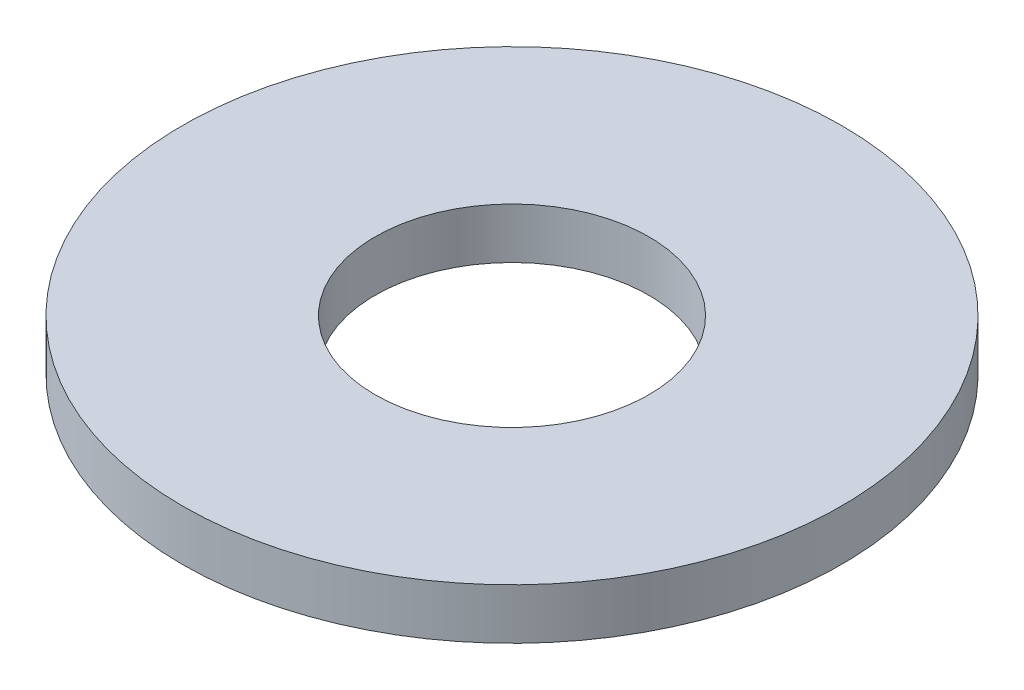
from build123d import *

# Parameters (mm, degrees)
ESQUISSE1_R        = 3.25
ESQUISSE1_R_2      = 1.35
BOSS_EXTRU_1_DEPTH = 0.25


with BuildPart() as part:
    # Esquisse1 → Boss.-Extru.1 (new, symmetric)
    with BuildSketch(Plane(origin=(0, 0, 0), x_dir=(1, 0, 0), z_dir=(0, 1, 0))):
        with Locations(Location((0, 0, 0), (0, 0, 270))):
            Circle(ESQUISSE1_R)
        with Locations(Location((0, 0, 0), (0, 0, 270))):
            Circle(ESQUISSE1_R_2, mode=Mode.SUBTRACT)
    extrude(amount=BOSS_EXTRU_1_DEPTH, both=True)


solid = part.part
